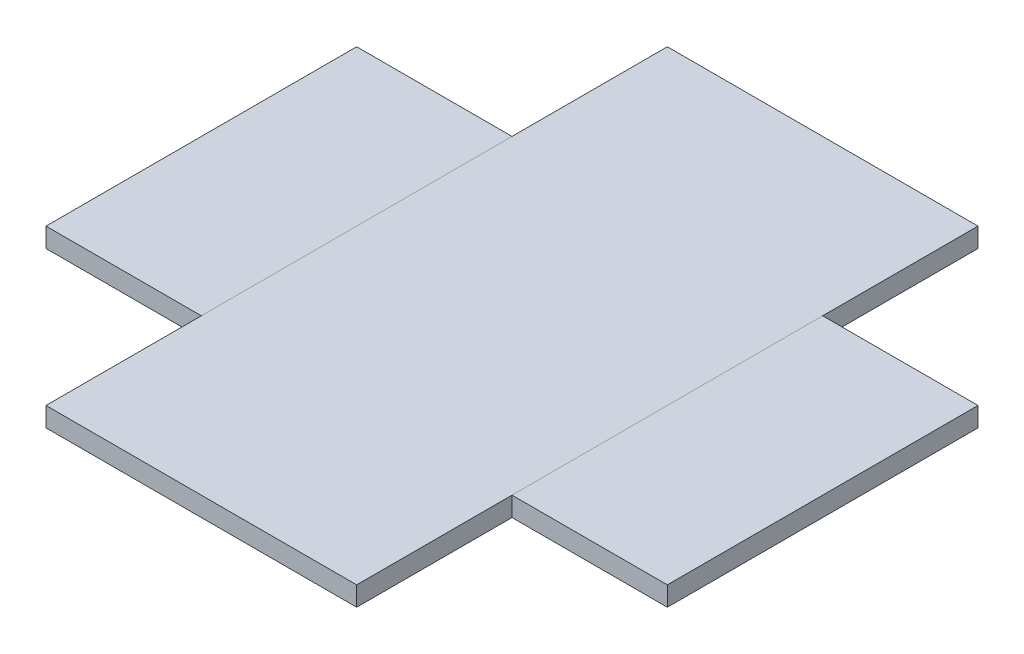
from build123d import *

# Parameters (mm, degrees)
SKETCH2_W           = 101.6
SKETCH2_H           = 50.8
BOSS_EXTRUDE2_DEPTH = 3.175
SKETCH3_W           = 50.8
SKETCH3_H           = 101.6
BOSS_EXTRUDE3_DEPTH = 3.175


with BuildPart() as part:
    # Sketch2 → Boss-Extrude2 (new body)
    with BuildSketch(Plane(origin=(0, 0, 0), x_dir=(1, 0, 0), z_dir=(0, 1, 0))):
        Rectangle(SKETCH2_W, SKETCH2_H)
    extrude(amount=BOSS_EXTRUDE2_DEPTH)


with BuildPart() as body_2:
    # Sketch3 → Boss-Extrude3 (new body)
    with BuildSketch(Plane(origin=(0, 3.175, 0), x_dir=(1, 0, 0), z_dir=(0, 1, 0))):
        Rectangle(SKETCH3_W, SKETCH3_H)
    extrude(amount=-BOSS_EXTRUDE3_DEPTH)


solid = Compound([part.part, body_2.part])
